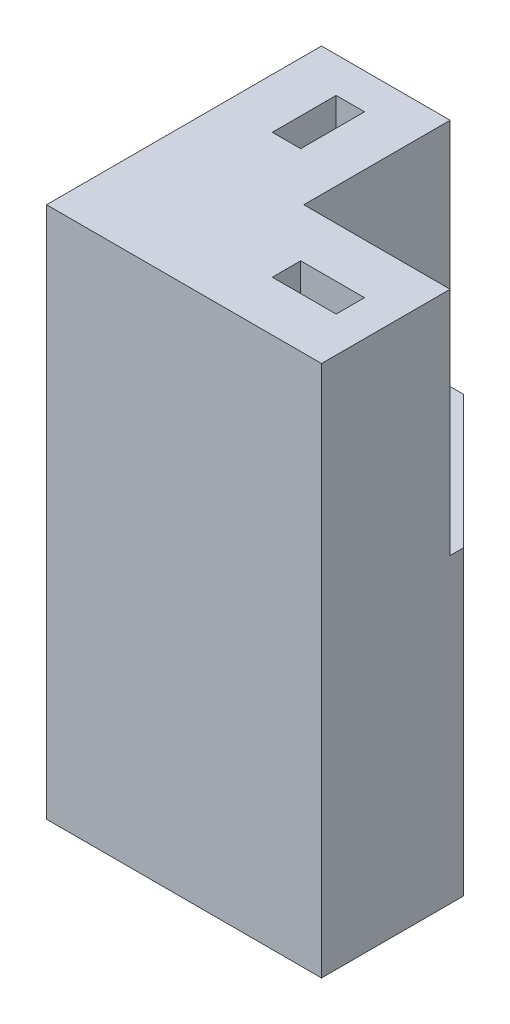
from build123d import *

# Parameters (mm, degrees)
SKETCH3_W           = 19.685
SKETCH3_H           = 19.685
BOSS_EXTRUDE2_DEPTH = 38.1
SKETCH5_R           = 2.54
CUT_EXTRUDE2_DEPTH  = 5.715
SKETCH6_W           = 10.4775
SKETCH6_H           = 10.4775
CUT_EXTRUDE3_DEPTH  = 16.51
SKETCH7_W           = 2.032
SKETCH7_H           = 4.572
SKETCH7_W_2         = 4.572
SKETCH7_H_2         = 2.032
CUT_EXTRUDE4_DEPTH  = 5.08
CHAMFER1_SIZE       = 9.525


with BuildPart() as part:
    # Sketch3 → Boss-Extrude2 (new body)
    with BuildSketch(Plane(origin=(0, 0, 0), x_dir=(1, 0, 0), z_dir=(0, 1, 0))):
        Rectangle(SKETCH3_W, SKETCH3_H)
    extrude(amount=BOSS_EXTRUDE2_DEPTH)

    # Sketch5 → Cut-Extrude2 (cut)
    with BuildSketch(Plane.XZ):
        with Locations(Location((-4.92125, 4.92125, 0), (0, 0, 270))):
            Circle(SKETCH5_R)
    extrude(amount=-CUT_EXTRUDE2_DEPTH, mode=Mode.SUBTRACT)

    # Sketch6 → Cut-Extrude3 (cut)
    with BuildSketch(Plane(origin=(0, 38.1, 0), x_dir=(1, 0, 0), z_dir=(0, 1, 0))):
        with Locations((4.60375, 4.60375)):
            Rectangle(SKETCH6_W, SKETCH6_H)
    extrude(amount=-CUT_EXTRUDE3_DEPTH, mode=Mode.SUBTRACT)

    # Sketch7 → Cut-Extrude4 (cut)
    with BuildSketch(Plane(origin=(0, 38.1, 0), x_dir=(1, 0, 0), z_dir=(0, 1, 0))):
        with Locations((-5.23875, 5.0165)):
            Rectangle(SKETCH7_W, SKETCH7_H)
        with Locations((5.0165, -5.23875)):
            Rectangle(SKETCH7_W_2, SKETCH7_H_2)
    extrude(amount=-CUT_EXTRUDE4_DEPTH, mode=Mode.SUBTRACT)

    # Chamfer1
    chamfer1_edges = [part.edges().sort_by_distance(p)[0] for p in [
        (9.8425, 10.795, -9.8425),
    ]]
    chamfer(chamfer1_edges, length=CHAMFER1_SIZE)


solid = part.part
